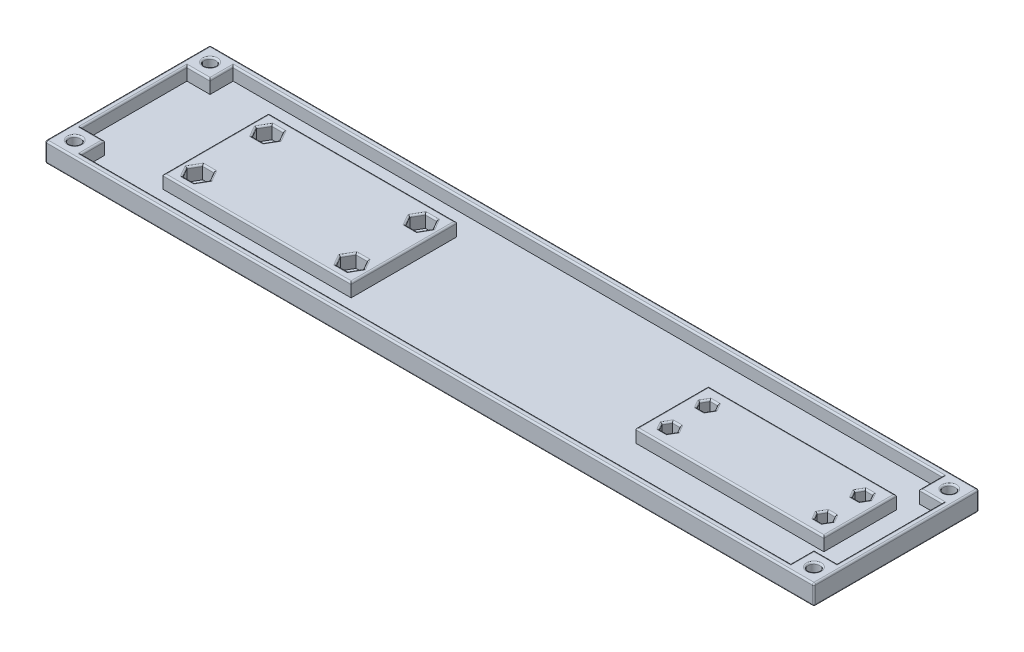
from build123d import *

# Parameters (mm, degrees)
SKETCH1_W             = 233
SKETCH1_H             = 50
SKETCH1_R             = 1.75
BOSS_EXTRUDE1_DEPTH   = 4
SKETCH1_W_2           = 57
SKETCH1_H_2           = 32
BOSS_EXTRUDE1_2_DEPTH = 4
SKETCH1_H_3           = 22
BOSS_EXTRUDE1_3_DEPTH = 4
BOSS_EXTRUDE2_START   = -2
SKETCH1_3_W           = 233
SKETCH1_3_H           = 50
SKETCH1_3_R           = 1.75
SKETCH1_3_R_2         = 1.25
BOSS_EXTRUDE2_DEPTH   = 2
FILLET1_R             = 0.5


with BuildPart() as part:
    # Sketch1 → Boss-Extrude1 (new body)
    with BuildSketch(Plane(origin=(0, 0, -41.346600172), x_dir=(1, 0, 0), z_dir=(0, 1, 0))):
        with Locations((84.5, 10.5)):
            Rectangle(SKETCH1_W, SKETCH1_H)
        Polygon((-30, 26.5), (-23, 26.5), (-23, 33.5), (192, 33.5), (192, 26.5), (199, 26.5), (199, -5.5), (192, -5.5), (192, -12.5), (-23, -12.5), (-23, -5.5), (-30, -5.5), align=None, mode=Mode.SUBTRACT)
        with Locations((-27.5, 31)):
            Circle(SKETCH1_R, mode=Mode.SUBTRACT)
        with Locations((-27.5, -10)):
            Circle(SKETCH1_R, mode=Mode.SUBTRACT)
        with Locations((196.5, 31)):
            Circle(SKETCH1_R, mode=Mode.SUBTRACT)
        with Locations((196.5, -10)):
            Circle(SKETCH1_R, mode=Mode.SUBTRACT)
    extrude(amount=BOSS_EXTRUDE1_DEPTH)



with BuildPart() as body_2:
    # Sketch1 → Boss-Extrude1 2 (new body)
    with BuildSketch(Plane(origin=(0, 0, -41.346600172), x_dir=(1, 0, 0), z_dir=(0, 1, 0))):
        with Locations((23.25, 10.5)):
            Rectangle(SKETCH1_W_2, SKETCH1_H_2)
        Polygon((1.732050808, 3), (3.464101615, 0), (1.732050808, -3), (-1.732050808, -3), (-3.464101615, 0), (-1.732050808, 3), align=None, mode=Mode.SUBTRACT)
        Polygon((44.767949192, -3), (43.035898385, 0), (44.767949192, 3), (48.232050808, 3), (49.964101615, 0), (48.232050808, -3), align=None, mode=Mode.SUBTRACT)
        Polygon((-1.732050808, 24), (1.732050808, 24), (3.464101615, 21), (1.732050808, 18), (-1.732050808, 18), (-3.464101615, 21), align=None, mode=Mode.SUBTRACT)
        Polygon((44.767949192, 18), (43.035898385, 21), (44.767949192, 24), (48.232050808, 24), (49.964101615, 21), (48.232050808, 18), align=None, mode=Mode.SUBTRACT)
    extrude(amount=BOSS_EXTRUDE1_2_DEPTH)


with BuildPart() as body_3:
    # Sketch1 → Boss-Extrude1 3 (new body)
    with BuildSketch(Plane(origin=(0, 0, -41.346600172), x_dir=(1, 0, 0), z_dir=(0, 1, 0))):
        with Locations((161.5, 10.5)):
            Rectangle(SKETCH1_W_2, SKETCH1_H_3)
        Polygon((139.154700538, 6.8), (140.309401077, 4.8), (139.154700538, 2.8), (136.845299462, 2.8), (135.690598923, 4.8), (136.845299462, 6.8), align=None, mode=Mode.SUBTRACT)
        Polygon((183.845299462, 2.8), (182.690598923, 4.8), (183.845299462, 6.8), (186.154700538, 6.8), (187.309401077, 4.8), (186.154700538, 2.8), align=None, mode=Mode.SUBTRACT)
        Polygon((136.845299462, 14.2), (135.690598923, 16.2), (136.845299462, 18.2), (139.154700538, 18.2), (140.309401077, 16.2), (139.154700538, 14.2), align=None, mode=Mode.SUBTRACT)
        Polygon((183.845299462, 14.2), (182.690598923, 16.2), (183.845299462, 18.2), (186.154700538, 18.2), (187.309401077, 16.2), (186.154700538, 14.2), align=None, mode=Mode.SUBTRACT)
    extrude(amount=BOSS_EXTRUDE1_3_DEPTH)


with BuildPart() as part_1:
    add(part.part)

    add(body_2.part)  # Boss-Extrude2 merges body 2

    add(body_3.part)  # Boss-Extrude2 merges body 3
    # Sketch1<3> → Boss-Extrude2 (add)
    with BuildSketch(Plane(origin=(0, 0, -41.346600172), x_dir=(1, 0, 0), z_dir=(0, 1, 0)).offset(BOSS_EXTRUDE2_START)):
        with Locations((84.5, 10.5)):
            Rectangle(SKETCH1_3_W, SKETCH1_3_H)
        with Locations((0, 21)):
            Circle(SKETCH1_3_R, mode=Mode.SUBTRACT)
        Circle(SKETCH1_3_R, mode=Mode.SUBTRACT)
        with Locations((46.5, 0)):
            Circle(SKETCH1_3_R, mode=Mode.SUBTRACT)
        with Locations((46.5, 21)):
            Circle(SKETCH1_3_R, mode=Mode.SUBTRACT)
        with Locations((-27.5, 31)):
            Circle(SKETCH1_3_R, mode=Mode.SUBTRACT)
        with Locations((196.5, 31)):
            Circle(SKETCH1_3_R, mode=Mode.SUBTRACT)
        with Locations((196.5, -10)):
            Circle(SKETCH1_3_R, mode=Mode.SUBTRACT)
        with Locations((-27.5, -10)):
            Circle(SKETCH1_3_R, mode=Mode.SUBTRACT)
        with Locations((185, 16.2)):
            Circle(SKETCH1_3_R_2, mode=Mode.SUBTRACT)
        with Locations((138, 4.8)):
            Circle(SKETCH1_3_R_2, mode=Mode.SUBTRACT)
        with Locations((185, 4.8)):
            Circle(SKETCH1_3_R_2, mode=Mode.SUBTRACT)
        with Locations((138, 16.2)):
            Circle(SKETCH1_3_R_2, mode=Mode.SUBTRACT)
    extrude(amount=BOSS_EXTRUDE2_DEPTH)

    # Fillet1
    fillet1_edges = [part_1.edges().sort_by_distance(p)[0] for p in [
        (-32, 1, -76.846600172),
        (201, 1, -26.846600172),
        (-32, 1, -26.846600172),
        (84.5, 4, -26.846600172),
        (201, 4, -51.846600172),
        (-32, 4, -51.846600172),
        (195.5, 4, -67.846600172),
        (192, 4, -71.346600172),
        (194.75, 4, -72.346600172),
        (192, 4, -32.346600172),
        (195.5, 4, -35.846600172),
        (194.75, 4, -31.346600172),
        (-26.5, 4, -35.846600172),
        (-23, 4, -32.346600172),
        (-29.25, 4, -31.346600172),
        (-23, 4, -71.346600172),
        (-26.5, 4, -67.846600172),
        (-29.25, 4, -72.346600172),
        (139.732050808, 4, -47.146600172),
        (138, 4, -48.146600172),
        (136.267949192, 4, -47.146600172),
        (136.267949192, 4, -45.146600172),
        (138, 4, -44.146600172),
        (139.732050808, 4, -45.146600172),
        (183.267949192, 4, -45.146600172),
        (185, 4, -44.146600172),
        (186.732050808, 4, -45.146600172),
        (186.732050808, 4, -47.146600172),
        (185, 4, -48.146600172),
        (183.267949192, 4, -47.146600172),
        (183.267949192, 4, -56.546600172),
        (185, 4, -55.546600172),
        (186.732050808, 4, -56.546600172),
        (186.732050808, 4, -58.546600172),
        (185, 4, -59.546600172),
        (183.267949192, 4, -58.546600172),
        (136.267949192, 4, -56.546600172),
        (138, 4, -55.546600172),
        (139.732050808, 4, -56.546600172),
        (139.732050808, 4, -58.546600172),
        (138, 4, -59.546600172),
        (136.267949192, 4, -58.546600172),
        (161.5, 4, -62.846600172),
        (190, 4, -51.846600172),
        (161.5, 4, -40.846600172),
        (133, 4, -51.846600172),
        (0, 4, -65.346600172),
        (-2.598076211, 4, -63.846600172),
        (-2.598076211, 4, -60.846600172),
        (0, 4, -59.346600172),
        (2.598076211, 4, -60.846600172),
        (2.598076211, 4, -63.846600172),
        (43.901923789, 4, -60.846600172),
        (46.5, 4, -59.346600172),
        (49.098076211, 4, -60.846600172),
        (49.098076211, 4, -63.846600172),
        (46.5, 4, -65.346600172),
        (43.901923789, 4, -63.846600172),
        (43.901923789, 4, -39.846600172),
        (46.5, 4, -38.346600172),
        (49.098076211, 4, -39.846600172),
        (49.098076211, 4, -42.846600172),
        (46.5, 4, -44.346600172),
        (43.901923789, 4, -42.846600172),
        (2.598076211, 4, -42.846600172),
        (0, 4, -44.346600172),
        (-2.598076211, 4, -42.846600172),
        (-2.598076211, 4, -39.846600172),
        (0, 4, -38.346600172),
        (2.598076211, 4, -39.846600172),
        (23.25, 4, -67.846600172),
        (51.75, 4, -51.846600172),
        (23.25, 4, -35.846600172),
        (-5.25, 4, -51.846600172),
        (201, 1, -76.846600172),
        (199, 4, -51.846600172),
        (84.5, 4, -74.846600172),
        (-30, 4, -51.846600172),
        (84.5, 4, -28.846600172),
        (84.5, 4, -76.846600172),
        (201, -2, -51.846600172),
        (84.5, -2, -76.846600172),
        (-32, -2, -51.846600172),
        (84.5, -2, -26.846600172),
    ]]
    fillet(fillet1_edges, radius=FILLET1_R)


solid = part_1.part
